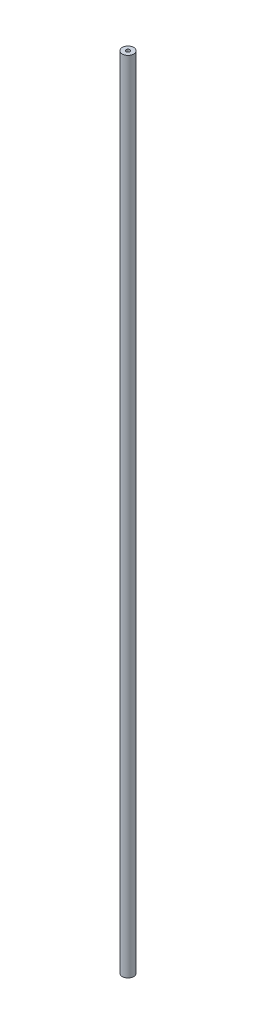
from build123d import *

# Parameters (mm, degrees)
SKETCH1_R                   = 7.9375
BOSS_EXTRUDE1_DEPTH         = 1104.9
F_1_4_20_TAPPED_HOLE1_D     = 5.1054
F_1_4_20_TAPPED_HOLE1_DEPTH = 23.866183098
F_1_4_20_TAPPED_HOLE1_TIP   = 1.533816902


with BuildPart() as part:
    # Sketch1 → Boss-Extrude1 (new body)
    with BuildSketch(Plane(origin=(0, 0, 0), x_dir=(1, 0, 0), z_dir=(0, 1, 0))):
        with Locations(Location((0, 0, 0), (0, 0, 270))):
            Circle(SKETCH1_R)
    extrude(amount=BOSS_EXTRUDE1_DEPTH)

    # 1/4-20 Tapped Hole1
    with Locations(Plane(origin=(0, 1104.9, 0), x_dir=(1, 0, 0), z_dir=(0, 1, 0))):
        with Locations((0, 0)):
            Hole(F_1_4_20_TAPPED_HOLE1_D / 2, depth=F_1_4_20_TAPPED_HOLE1_DEPTH)
            with Locations((0, 0, -(F_1_4_20_TAPPED_HOLE1_DEPTH + F_1_4_20_TAPPED_HOLE1_TIP / 2))):  # 118° drill point
                Cone(0, F_1_4_20_TAPPED_HOLE1_D / 2, F_1_4_20_TAPPED_HOLE1_TIP, mode=Mode.SUBTRACT)


solid = part.part
